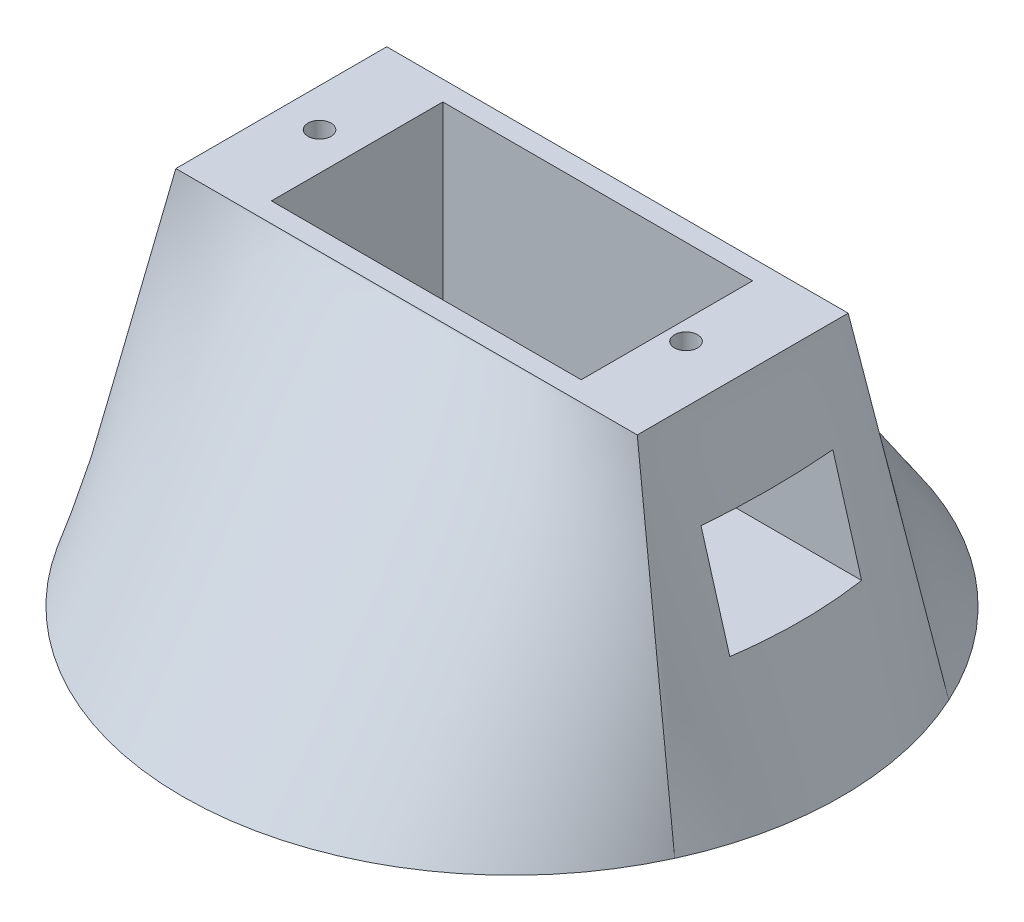
from build123d import *

# Parameters (mm, degrees)
SKETCH1_W           = 35
SKETCH1_H           = 16
BOSS_EXTRUDE1_DEPTH = 24
SKETCH3_W           = 23.5
SKETCH3_H           = 13
CUT_EXTRUDE1_DEPTH  = 15.7
SKETCH5_R           = 0.875
CUT_EXTRUDE2_DEPTH  = 8
CUT_EXTRUDE3_REACH  = 52.513
SKETCH9_W           = 10
SKETCH9_H           = 7.5


with BuildPart() as part:
    # Sketch1 → Boss-Extrude1 (new body)
    with BuildSketch(Plane(origin=(0, 0, 0), x_dir=(1, 0, 0), z_dir=(0, 1, 0))):
        Rectangle(SKETCH1_W, SKETCH1_H)
    extrude(amount=BOSS_EXTRUDE1_DEPTH)

    # Sketch8 → Loft1 section 0
    with BuildSketch(Plane(origin=(0, 24, 0), x_dir=(1, 0, 0), z_dir=(0, 1, 0))):
        with BuildLine():
            Line((17.5, -8), (-17.5, -8))
            Line((-17.5, -8), (-17.5, 8))
            Line((-17.5, 8), (17.5, 8))
            Line((17.5, 8), (17.5, -8))
        make_face()
    # Sketch7 for Loft1 → Loft1 section 1
    with BuildSketch(Plane.XZ):
        with BuildLine():
            # circular arc as an exact rational Bezier (weights 1, cos(half-angle), 1)
            Bezier((22.73686189, 10.393994007), (0, 60.130879387), (-22.73686189, 10.393994007), weights=[1, 0.41575976, 1])
            Bezier((-22.73686189, 10.393994007), (-27.488402007, 0), (-22.73686189, -10.393994007), weights=[1, 0.909474476, 1])
            Bezier((-22.73686189, -10.393994007), (0, -60.130879387), (22.73686189, -10.393994007), weights=[1, 0.41575976, 1])
            Bezier((22.73686189, -10.393994007), (27.488402007, 0), (22.73686189, 10.393994007), weights=[1, 0.909474476, 1])
        make_face()
    loft()

    # Sketch3 → Cut-Extrude1 (cut)
    with BuildSketch(Plane.XZ.offset(-24)):
        Rectangle(SKETCH3_W, SKETCH3_H)
    extrude(amount=CUT_EXTRUDE1_DEPTH, mode=Mode.SUBTRACT)

    # Sketch5 → Cut-Extrude2 (cut)
    with BuildSketch(Plane(origin=(0, 24, 0), x_dir=(1, 0, 0), z_dir=(0, 1, 0))):
        with Locations(Location((13.2, 0, 0), (0, 0, 270))):
            Circle(SKETCH5_R)
        with Locations(Location((-14.6, 0, 0), (0, 0, 270))):
            Circle(SKETCH5_R)
    extrude(amount=-CUT_EXTRUDE2_DEPTH, mode=Mode.SUBTRACT)

    # Sketch9 → Cut-Extrude3 (cut, up to next)
    with BuildSketch(Plane.ZY.offset(-11.75), mode=Mode.PRIVATE) as cut_extrude3_sk1:
        with Locations((0, 13.7)):
            Rectangle(SKETCH9_W, SKETCH9_H)
    cut_extrude3_tool1 = extrude(cut_extrude3_sk1.sketch, amount=-CUT_EXTRUDE3_REACH, mode=Mode.PRIVATE) & part.part
    add(cut_extrude3_tool1.solids().sort_by_distance((11.75, 13.7, 0))[0], mode=Mode.SUBTRACT)


solid = part.part
